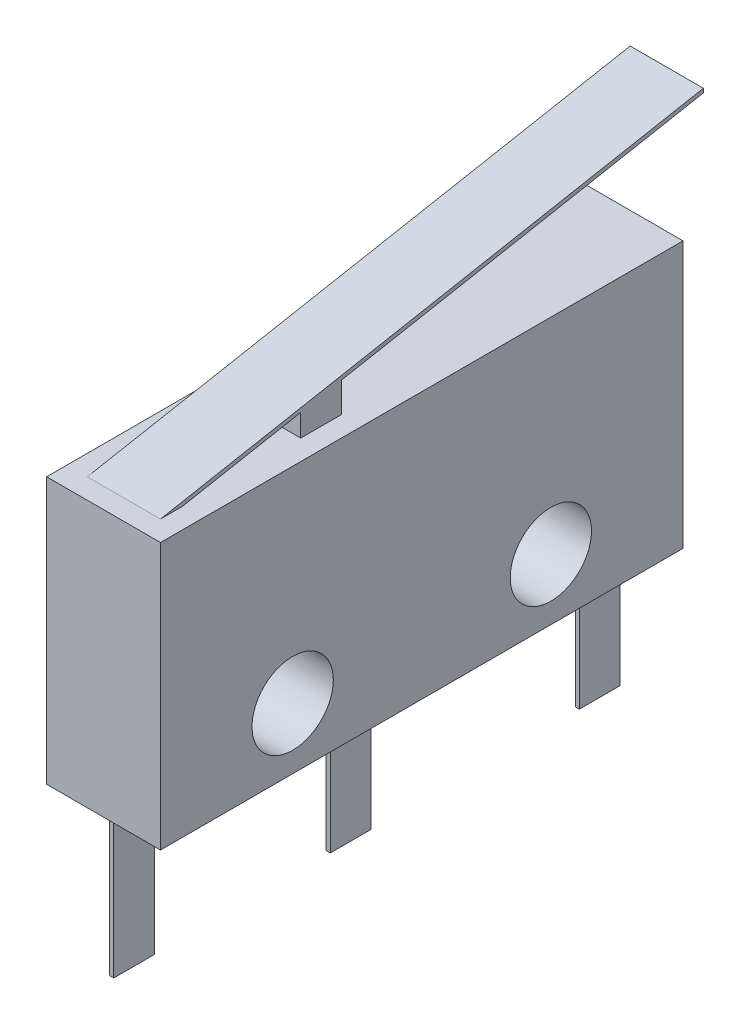
from build123d import *

# Parameters (mm, degrees)
BODYSKETCH1_W                = 12.85
BODYSKETCH1_H                = 6.55
BODYSKETCH1_R                = 1
BODYBOSS_EXTRUDE1_DEPTH      = 2.8
SKETCH2_W                    = 1.8
SKETCH2_H                    = 13.35
LEVERBOSS_EXTRUDE2_DEPTH     = 2.5
LEVERCUT_EXTRUDE1_DEPTH      = 17.703742096
BUTTONBOSS_EXTRUDE3_REACH    = 17.574
SKETCH4_W                    = 1.8
SKETCH4_H                    = 1
SKETCH5_W                    = 0.1
SKETCH5_H                    = 1
TEREMINALBOSS_EXTRUDE4_DEPTH = 3.5


with BuildPart() as part:
    # BodySketch1 → BodyBoss-Extrude1 (new body)
    with BuildSketch(Plane(origin=(0, 0, 0), x_dir=(0, 0, -1), z_dir=(1, 0, 0))):
        with Locations((6.425, 3.275)):
            Rectangle(BODYSKETCH1_W, BODYSKETCH1_H)
        with Locations((3.25, 1.5)):
            Circle(BODYSKETCH1_R, mode=Mode.SUBTRACT)
        with Locations((9.6, 1.5)):
            Circle(BODYSKETCH1_R, mode=Mode.SUBTRACT)
    extrude(amount=BODYBOSS_EXTRUDE1_DEPTH)

    # Sketch2 → LeverBoss-Extrude2 (add)
    with BuildSketch(Plane(origin=(0, 6.55, 0), x_dir=(1, 0, 0), z_dir=(0, 1, 0))):
        with Locations((1.4, 7.175)):
            Rectangle(SKETCH2_W, SKETCH2_H)
    extrude(amount=LEVERBOSS_EXTRUDE2_DEPTH)

    # Sketch3 → LeverCut-Extrude1 (cut, through all)
    with BuildSketch(Plane(origin=(2.3, 0, 0), x_dir=(0, 0, -1), z_dir=(1, 0, 0))):
        Polygon((0.5, 6.55), (13.85, 9.05), (0.5, 9.05), align=None)
        Polygon((13.85, 8.95), (13.85, 6.55), (1.034, 6.55), align=None)
    extrude(amount=-LEVERCUT_EXTRUDE1_DEPTH, mode=Mode.SUBTRACT)

    # ButtonBoss-Extrude3: up to this plane
    buttonboss_extrude3_end = Plane(origin=(0, 6.55, -1.034), z_dir=(0, 0.982913837182172, 0.1840662616446014))
    # Sketch4 → ButtonBoss-Extrude3 (add, up to the surface)
    with BuildSketch(Plane(origin=(0, 6.55, 0), x_dir=(1, 0, 0), z_dir=(0, 1, 0)), mode=Mode.PRIVATE) as buttonboss_extrude3_sk1:
        with Locations((1.4, 4.448948019)):
            Rectangle(SKETCH4_W, SKETCH4_H)
    buttonboss_extrude3_tool1 = split(extrude(buttonboss_extrude3_sk1.sketch, amount=BUTTONBOSS_EXTRUDE3_REACH, mode=Mode.PRIVATE), bisect_by=buttonboss_extrude3_end, keep=Keep.BOTH, mode=Mode.PRIVATE)
    add(buttonboss_extrude3_tool1.solids().sort_by_distance((1.4, 6.55, -4.448948))[0])

    # Sketch5 → TereminalBoss-Extrude4 (add)
    with BuildSketch(Plane.XZ):
        with Locations((1.4, -0.7)):
            Rectangle(SKETCH5_W, SKETCH5_H)
        with Locations((1.4, -6.025)):
            Rectangle(SKETCH5_W, SKETCH5_H)
        with Locations((1.4, -12.15)):
            Rectangle(SKETCH5_W, SKETCH5_H)
    extrude(amount=TEREMINALBOSS_EXTRUDE4_DEPTH)


solid = part.part
